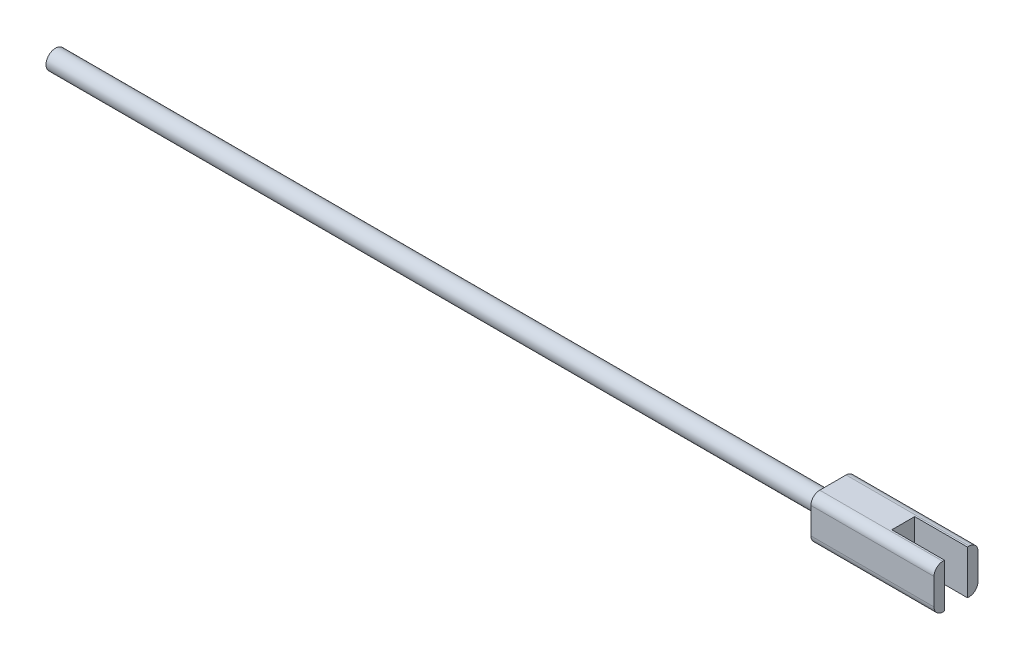
from build123d import *

# Parameters (mm, degrees)
SKETCH1_R               = 1.09
BOSS_EXTRUDE1_DEPTH     = 90.392
BOSS_EXTRUDE2_DEPTH     = 14
CUT_EXTRUDE1_DEPTH      = 103.453021742
CUT_EXTRUDE1_DEPTH_BACK = 103.453021742
SKETCH3_W               = 7
SKETCH3_H               = 2.6


with BuildPart() as part:
    # Sketch1 → Boss-Extrude1 (new body)
    with BuildSketch(Plane(origin=(0, 0, 0), x_dir=(0, 0, -1), z_dir=(1, 0, 0))):
        Circle(SKETCH1_R)
    extrude(amount=BOSS_EXTRUDE1_DEPTH)

    # Sketch2 → Boss-Extrude2 (add)
    with BuildSketch(Plane(origin=(88.392, 0, 0), x_dir=(0, 0, -1), z_dir=(1, 0, 0))):
        with BuildLine():
            Line((-1.5, -2.5), (1.5, -2.5))
            ThreePointArc((1.5, -2.5), (2.207106781, -2.207106781), (2.5, -1.5))
            Line((2.5, -1.5), (2.5, 1.5))
            ThreePointArc((2.5, 1.5), (2.207106781, 2.207106781), (1.5, 2.5))
            Line((1.5, 2.5), (-1.5, 2.5))
            ThreePointArc((-1.5, 2.5), (-2.207106781, 2.207106781), (-2.5, 1.5))
            Line((-2.5, 1.5), (-2.5, -1.5))
            ThreePointArc((-2.5, -1.5), (-2.207106781, -2.207106781), (-1.5, -2.5))
        make_face()
    extrude(amount=BOSS_EXTRUDE2_DEPTH)

    # Sketch3 → Cut-Extrude1 (cut, two sides: drawn at the far end of the back side and taken through both)
    with BuildSketch(Plane(origin=(0, 0, 0), x_dir=(1, 0, 0), z_dir=(0, 1, 0)).offset(-CUT_EXTRUDE1_DEPTH_BACK)):
        with Locations((99.892, 0)):
            Rectangle(SKETCH3_W, SKETCH3_H)
    extrude(amount=CUT_EXTRUDE1_DEPTH + CUT_EXTRUDE1_DEPTH_BACK, mode=Mode.SUBTRACT)


solid = part.part
